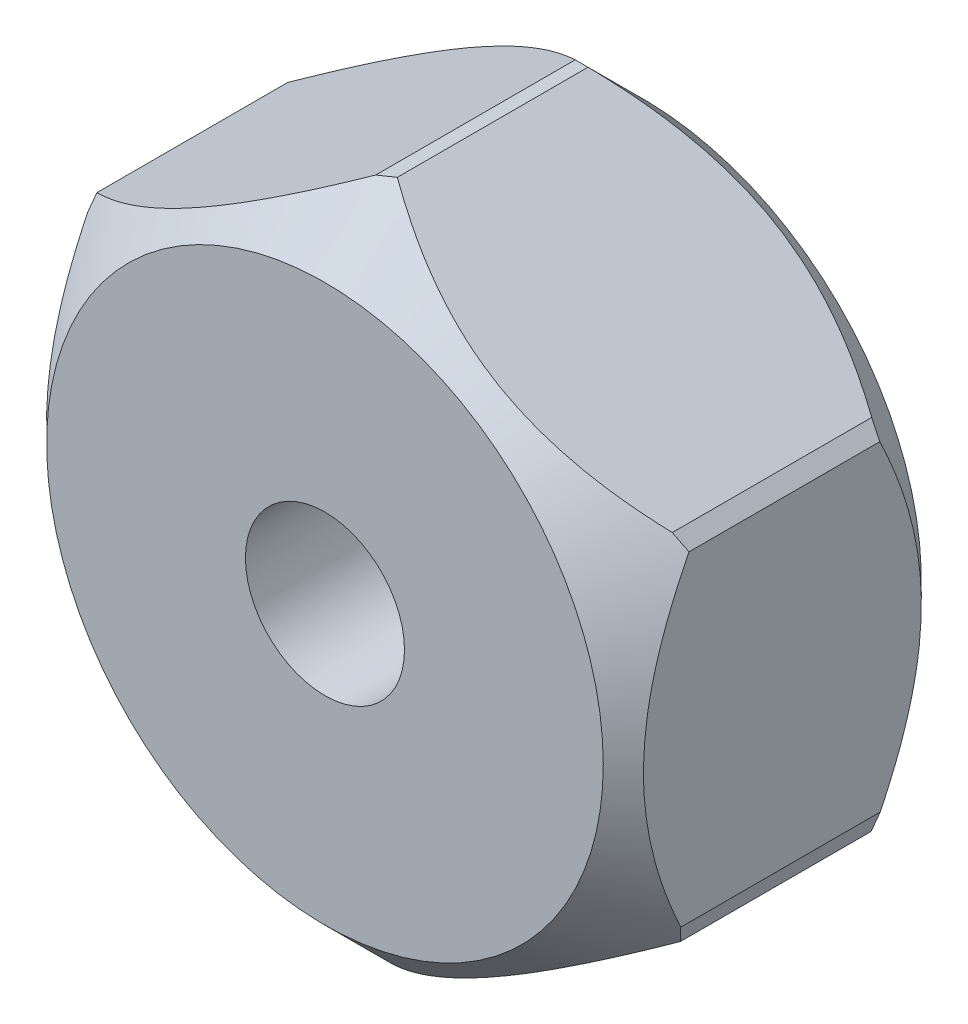
from build123d import *
from OCP.BRepFilletAPI import BRepFilletAPI_MakeChamfer

# Parameters (mm, degrees)
BOSS_EXTRUDE1_DEPTH = 12
SKETCH2_OUTSIDE_W   = 51.976
SKETCH2_OUTSIDE_H   = 55.304
SKETCH2_OUTSIDE_R   = 10.5
CUT_EXTRUDE1_DEPTH  = 10
CUT_EXTRUDE1_DRAFT  = -45
SKETCH3_OUTSIDE_W   = 51.976
SKETCH3_OUTSIDE_H   = 55.304
SKETCH3_OUTSIDE_R   = 10.5
CUT_EXTRUDE2_DEPTH  = 10
CUT_EXTRUDE2_DRAFT  = -45
CHAMFER2_SIZE       = 0.2
CHAMFER2_SIZE2      = 0.546410162
SKETCH5_R           = 3
CUT_EXTRUDE5_DEPTH  = 20


with BuildPart() as part:
    # Sketch1 → Boss-Extrude1 (new body)
    with BuildSketch(Plane.XY):
        Polygon((11.180698914, -6.634461418), (11.335961585, 6.365538582), (0.155262671, 13), (-11.180698914, 6.634461418), (-11.335961585, -6.365538582), (-0.155262671, -13), align=None)
    extrude(amount=BOSS_EXTRUDE1_DEPTH)


with BuildPart() as cut_extrude1_tool:
    # Sketch2 outside → Cut-Extrude1 (with draft: the straight prism first)
    with BuildSketch(Plane.XY.offset(12)):
        Rectangle(SKETCH2_OUTSIDE_W, SKETCH2_OUTSIDE_H)
        Circle(SKETCH2_OUTSIDE_R, mode=Mode.SUBTRACT)
    extrude(amount=-CUT_EXTRUDE1_DEPTH)
    # Cut-Extrude1: the draft: its side faces are tilted about the plane it starts from
    cut_extrude1_sides = [cut_extrude1_tool.faces().sort_by_distance(p)[0] for p in [
        (0, -27.652, 7),
        (25.988, 0, 7),
        (0, 27.652, 7),
        (-25.988, 0, 7),
        (-10.5, 0, 7),
    ]]
    draft(cut_extrude1_sides, Plane.XY.offset(12), CUT_EXTRUDE1_DRAFT)


with BuildPart() as part_1:
    add(part.part)

    # Cut-Extrude1: cut by cut_extrude1_tool
    add(cut_extrude1_tool.part, mode=Mode.SUBTRACT)


with BuildPart() as cut_extrude2_tool:
    # Sketch3 outside → Cut-Extrude2 (with draft: the straight prism first)
    with BuildSketch(Plane(origin=(0, 0, 0), x_dir=(-1, 0, 0), z_dir=(0, 0, -1))):
        Rectangle(SKETCH3_OUTSIDE_W, SKETCH3_OUTSIDE_H)
        Circle(SKETCH3_OUTSIDE_R, mode=Mode.SUBTRACT)
    extrude(amount=-CUT_EXTRUDE2_DEPTH)
    # Cut-Extrude2: the draft: its side faces are tilted about the plane it starts from
    cut_extrude2_sides = [cut_extrude2_tool.faces().sort_by_distance(p)[0] for p in [
        (0, -27.652, 5),
        (-25.988, 0, 5),
        (0, 27.652, 5),
        (25.988, 0, 5),
        (10.5, 0, 5),
    ]]
    draft(cut_extrude2_sides, Plane(origin=(0, 0, 0), x_dir=(-1, 0, 0), z_dir=(0, 0, -1)), CUT_EXTRUDE2_DRAFT)


with BuildPart() as part_2:
    add(part_1.part)

    # Cut-Extrude2: cut by cut_extrude2_tool
    add(cut_extrude2_tool.part, mode=Mode.SUBTRACT)

    # Chamfer2: one chamfer whose edges measure the first distance from different faces: ONE call of the kernel's chamfer builder (chamfer() names one face for all edges)
    chamfer2_edges_1 = [part_2.edges().sort_by_distance(p)[0] for p in [
        (11.335961585, 6.365538582, 6),
    ]]
    chamfer2_side_1 = [part_2.faces().sort_by_distance(p)[0] for p in [
        (11.258330249, -0.134461418, 6),
    ]]
    chamfer2_edges_2 = [part_2.edges().sort_by_distance(p)[0] for p in [
        (0.155262671, 13, 6),
    ]]
    chamfer2_side_2 = [part_2.faces().sort_by_distance(p)[0] for p in [
        (5.745612128, 9.682769291, 6),
    ]]
    chamfer2_edges_3 = [part_2.edges().sort_by_distance(p)[0] for p in [
        (-11.180698914, 6.634461418, 6),
    ]]
    chamfer2_side_3 = [part_2.faces().sort_by_distance(p)[0] for p in [
        (-5.512718121, 9.817230709, 6),
    ]]
    chamfer2_edges_4 = [part_2.edges().sort_by_distance(p)[0] for p in [
        (-11.335961585, -6.365538582, 6),
    ]]
    chamfer2_side_4 = [part_2.faces().sort_by_distance(p)[0] for p in [
        (-11.258330249, 0.134461418, 6),
    ]]
    chamfer2_edges_5 = [part_2.edges().sort_by_distance(p)[0] for p in [
        (-0.155262671, -13, 6),
    ]]
    chamfer2_side_5 = [part_2.faces().sort_by_distance(p)[0] for p in [
        (-5.745612128, -9.682769291, 6),
    ]]
    chamfer2_edges_6 = [part_2.edges().sort_by_distance(p)[0] for p in [
        (11.180698914, -6.634461418, 6),
    ]]
    chamfer2_side_6 = [part_2.faces().sort_by_distance(p)[0] for p in [
        (5.512718121, -9.817230709, 6),
    ]]
    chamfer2 = BRepFilletAPI_MakeChamfer(part_2.part.solid().wrapped)
    for e in chamfer2_edges_1:
        chamfer2.Add(CHAMFER2_SIZE, CHAMFER2_SIZE2, e.wrapped, chamfer2_side_1[0].wrapped)  # the first distance lies on this face
    for e in chamfer2_edges_2:
        chamfer2.Add(CHAMFER2_SIZE, CHAMFER2_SIZE2, e.wrapped, chamfer2_side_2[0].wrapped)  # the first distance lies on this face
    for e in chamfer2_edges_3:
        chamfer2.Add(CHAMFER2_SIZE, CHAMFER2_SIZE2, e.wrapped, chamfer2_side_3[0].wrapped)  # the first distance lies on this face
    for e in chamfer2_edges_4:
        chamfer2.Add(CHAMFER2_SIZE, CHAMFER2_SIZE2, e.wrapped, chamfer2_side_4[0].wrapped)  # the first distance lies on this face
    for e in chamfer2_edges_5:
        chamfer2.Add(CHAMFER2_SIZE, CHAMFER2_SIZE2, e.wrapped, chamfer2_side_5[0].wrapped)  # the first distance lies on this face
    for e in chamfer2_edges_6:
        chamfer2.Add(CHAMFER2_SIZE, CHAMFER2_SIZE2, e.wrapped, chamfer2_side_6[0].wrapped)  # the first distance lies on this face
    add(Compound.cast(chamfer2.Shape()), mode=Mode.REPLACE)

    # Sketch5 → Cut-Extrude5 (cut)
    with BuildSketch(Plane(origin=(0, 0, 0), x_dir=(-1, 0, 0), z_dir=(0, 0, -1))):
        Circle(SKETCH5_R)
    extrude(amount=-CUT_EXTRUDE5_DEPTH, mode=Mode.SUBTRACT)


solid = part_2.part
